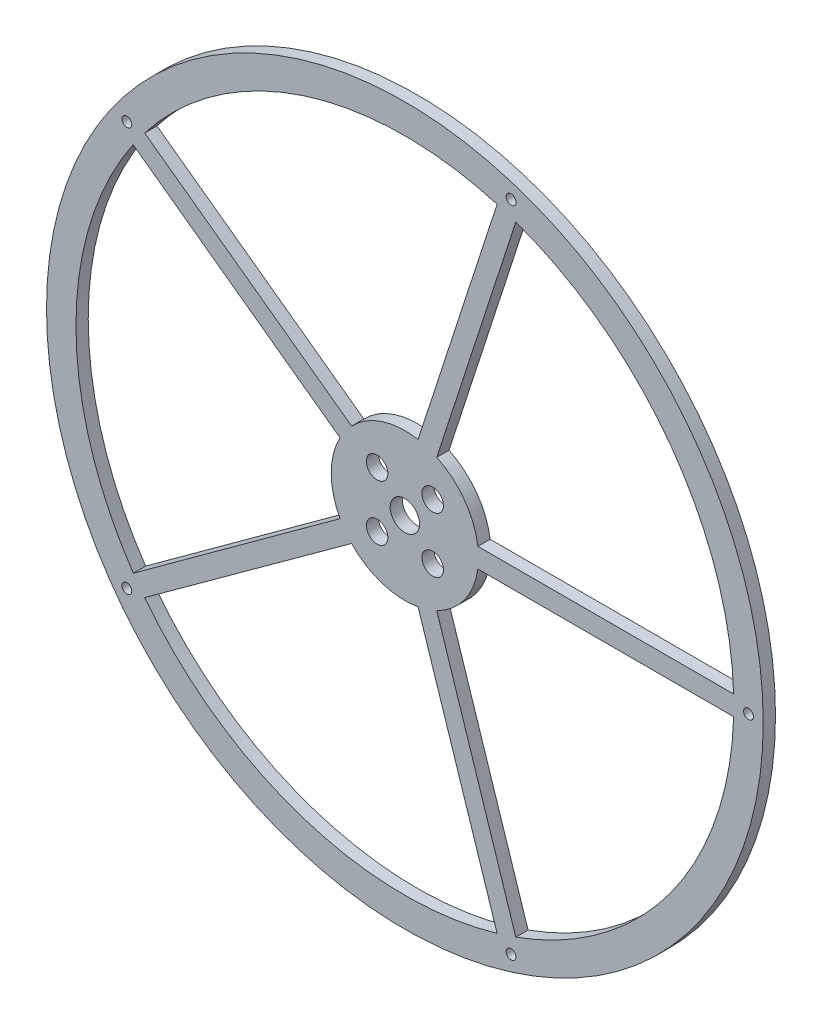
from build123d import *

# Parameters (mm, degrees)
SKETCH_3_R          = 73
EXTRUDE_3_DEPTH     = 2.5
SKETCH_5_R          = 67
CUT_EXTRUDE_1_DEPTH = 2.5
SKETCH_6_R          = 15
EXTRUDE_4_DEPTH     = 2.5
SKETCH_7_R          = 8
CUT_EXTRUDE_2_DEPTH = 2.5
EXTRUDE_6_DEPTH     = 2.5
EXTRUDE_7_DEPTH     = 2.5
EXTRUDE_8_DEPTH     = 2.5
EXTRUDE_9_DEPTH     = 2.5
EXTRUDE_10_DEPTH    = 2.5
SKETCH_14_R         = 8
CUT_EXTRUDE_3_DEPTH = 2.5
SKETCH_15_R         = 1
CUT_EXTRUDE_4_DEPTH = 2.5
SKETCH_16_R         = 8
EXTRUDE_11_DEPTH    = 2.5
SKETCH_17_R         = 3
CUT_EXTRUDE_5_DEPTH = 2.5
SKETCH_18_R         = 3.25
SKETCH_18_R_2       = 2.2
CUT_EXTRUDE_6_DEPTH = 2.5
SKETCH_19_R         = 3.25
EXTRUDE_12_DEPTH    = 2.5
SKETCH_20_R         = 2.2
CUT_EXTRUDE_7_DEPTH = 2.5


with BuildPart() as part:
    # 草图3 → 凸台-拉伸3 (new body)
    with BuildSketch(Plane.XY):
        Circle(SKETCH_3_R)
    extrude(amount=EXTRUDE_3_DEPTH)

    # 草图5 → 切除-拉伸1 (cut)
    with BuildSketch(Plane.XY.offset(2.5)):
        Circle(SKETCH_5_R)
    extrude(amount=-CUT_EXTRUDE_1_DEPTH, mode=Mode.SUBTRACT)



with BuildPart() as body_2:
    # 草图6 → 凸台-拉伸4 (new body)
    with BuildSketch(Plane.XY.offset(2.5)):
        Circle(SKETCH_6_R)
    extrude(amount=-EXTRUDE_4_DEPTH)

    # 草图7 → 切除-拉伸2 (cut)
    with BuildSketch(Plane.XY.offset(2.5)):
        Circle(SKETCH_7_R)
    extrude(amount=-CUT_EXTRUDE_2_DEPTH, mode=Mode.SUBTRACT)


with BuildPart() as part_1:
    add(part.part)

    add(body_2.part)  # 凸台-拉伸6 merges body 2
    # 草图9 → 凸台-拉伸6 (add)
    with BuildSketch(Plane.XY.offset(2.5)):
        with BuildLine():
            Line((0, 2), (0, 0))
            Line((0, 0), (0, -2))
            Line((0, -2), (66.970142601, -2))
            ThreePointArc((66.970142601, -2), (67, 0), (66.970142601, 2))
            Line((66.970142601, 2), (0, 2))
        make_face()
    extrude(amount=-EXTRUDE_6_DEPTH)

    # 草图10 → 凸台-拉伸7 (add)
    with BuildSketch(Plane.XY.offset(2.5)):
        with BuildLine():
            Line((1.902113033, -0.618033989), (0, 0))
            Line((0, 0), (-1.902113033, 0.618033989))
            Line((-1.902113033, 0.618033989), (18.792799147, 64.310424507))
            ThreePointArc((18.792799147, 64.310424507), (20.704138623, 63.720786592), (22.597025212, 63.074356529))
            Line((22.597025212, 63.074356529), (1.902113033, -0.618033989))
        make_face()
    extrude(amount=-EXTRUDE_7_DEPTH)

    # 草图11 → 凸台-拉伸8 (add)
    with BuildSketch(Plane.XY.offset(2.5)):
        with BuildLine():
            Line((0, 0), (1.175570505, 1.618033989))
            Line((1.175570505, 1.618033989), (-53.004412975, 40.982096154))
            ThreePointArc((-53.004412975, 40.982096154), (-54.204138623, 39.381611904), (-55.355553985, 37.746028176))
            Line((-55.355553985, 37.746028176), (-1.175570505, -1.618033989))
            Line((-1.175570505, -1.618033989), (0, 0))
        make_face()
    extrude(amount=-EXTRUDE_8_DEPTH)

    # 草图12 → 凸台-拉伸9 (add)
    with BuildSketch(Plane.XY.offset(2.5)):
        with BuildLine():
            Line((0, 0), (1.175570505, -1.618033989))
            Line((1.175570505, -1.618033989), (-53.004412975, -40.982096154))
            ThreePointArc((-53.004412975, -40.982096154), (-54.176759621, -39.419268347), (-55.30304181, -37.822923823))
            Line((-55.30304181, -37.822923823), (-1.175570505, 1.618033989))
            Line((-1.175570505, 1.618033989), (0, 0))
        make_face()
    extrude(amount=-EXTRUDE_9_DEPTH)

    # 草图13 → 凸台-拉伸10 (add)
    with BuildSketch(Plane.XY.offset(2.5)):
        with BuildLine():
            Line((0, 0), (1.902113033, 0.618033989))
            Line((1.902113033, 0.618033989), (22.597025212, -63.074356529))
            ThreePointArc((22.597025212, -63.074356529), (20.704138623, -63.720786592), (18.792799147, -64.310424507))
            Line((18.792799147, -64.310424507), (-1.902113033, -0.618033989))
            Line((-1.902113033, -0.618033989), (0, 0))
        make_face()
    extrude(amount=-EXTRUDE_10_DEPTH)

    # 草图14 → 切除-拉伸3 (cut)
    with BuildSketch(Plane.XY.offset(2.5)):
        Circle(SKETCH_14_R)
    extrude(amount=-CUT_EXTRUDE_3_DEPTH, mode=Mode.SUBTRACT)

    # 草图15 → 切除-拉伸4 (cut)
    with BuildSketch(Plane.XY.offset(2.5)):
        with Locations((70, 0)):
            Circle(SKETCH_15_R)
        with Locations((21.631189606, 66.573956141)):
            Circle(SKETCH_15_R)
        with Locations((-56.631189606, 41.14496766)):
            Circle(SKETCH_15_R)
        with Locations((-56.631189606, -41.14496766)):
            Circle(SKETCH_15_R)
        with Locations((21.631189606, -66.573956141)):
            Circle(SKETCH_15_R)
    extrude(amount=-CUT_EXTRUDE_4_DEPTH, mode=Mode.SUBTRACT)

    # 草图16 → 凸台-拉伸11 (add)
    with BuildSketch(Plane.XY.offset(2.5)):
        Circle(SKETCH_16_R)
    extrude(amount=-EXTRUDE_11_DEPTH)

    # 草图17 → 切除-拉伸5 (cut)
    with BuildSketch(Plane.XY.offset(2.5)):
        Circle(SKETCH_17_R)
    extrude(amount=-CUT_EXTRUDE_5_DEPTH, mode=Mode.SUBTRACT)

    # 草图18 → 切除-拉伸6 (cut)
    with BuildSketch(Plane.XY.offset(2.5)):
        with Locations((5.657, 5.657)):
            Circle(SKETCH_18_R)
        with Locations((-5.657, -5.657)):
            Circle(SKETCH_18_R)
        with Locations((5.657, -5.657)):
            Circle(SKETCH_18_R_2)
        with Locations((-5.657, 5.657)):
            Circle(SKETCH_18_R_2)
    extrude(amount=-CUT_EXTRUDE_6_DEPTH, mode=Mode.SUBTRACT)

    # 草图19 → 凸台-拉伸12 (add)
    with BuildSketch(Plane.XY.offset(2.5)):
        with Locations((5.657, 5.657)):
            Circle(SKETCH_19_R)
        with Locations((-5.657, -5.657)):
            Circle(SKETCH_19_R)
    extrude(amount=-EXTRUDE_12_DEPTH)

    # 草图20 → 切除-拉伸7 (cut)
    with BuildSketch(Plane.XY.offset(2.5)):
        with Locations((5.657, 5.657)):
            Circle(SKETCH_20_R)
        with Locations((-5.657, -5.657)):
            Circle(SKETCH_20_R)
    extrude(amount=-CUT_EXTRUDE_7_DEPTH, mode=Mode.SUBTRACT)


solid = part_1.part
